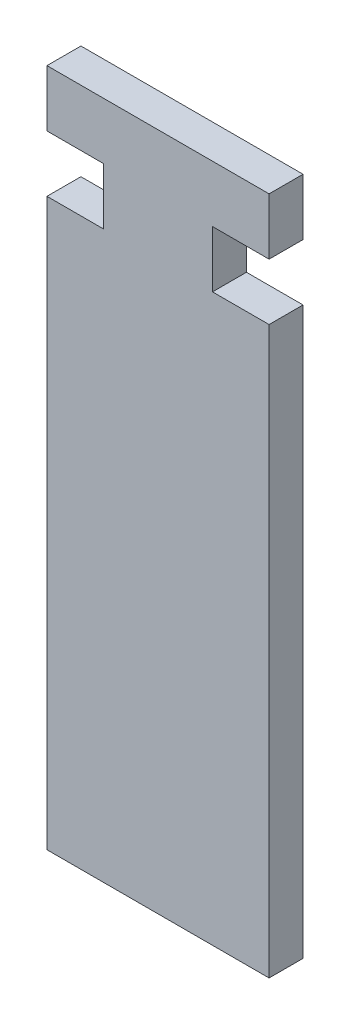
from build123d import *

# Parameters (mm, degrees)
BOSS_EXTRUDE1_DEPTH = 0.24


with BuildPart() as part:
    # Sketch1 → Boss-Extrude1 (new body)
    with BuildSketch(Plane.XY):
        Polygon((0, 0), (0, 4), (0.4, 4), (0.4, 4.4), (0, 4.4), (0, 4.8), (1.57, 4.8), (1.57, 4.4), (1.17, 4.4), (1.17, 4), (1.57, 4), (1.57, 0), align=None)
    extrude(amount=BOSS_EXTRUDE1_DEPTH)


solid = part.part
